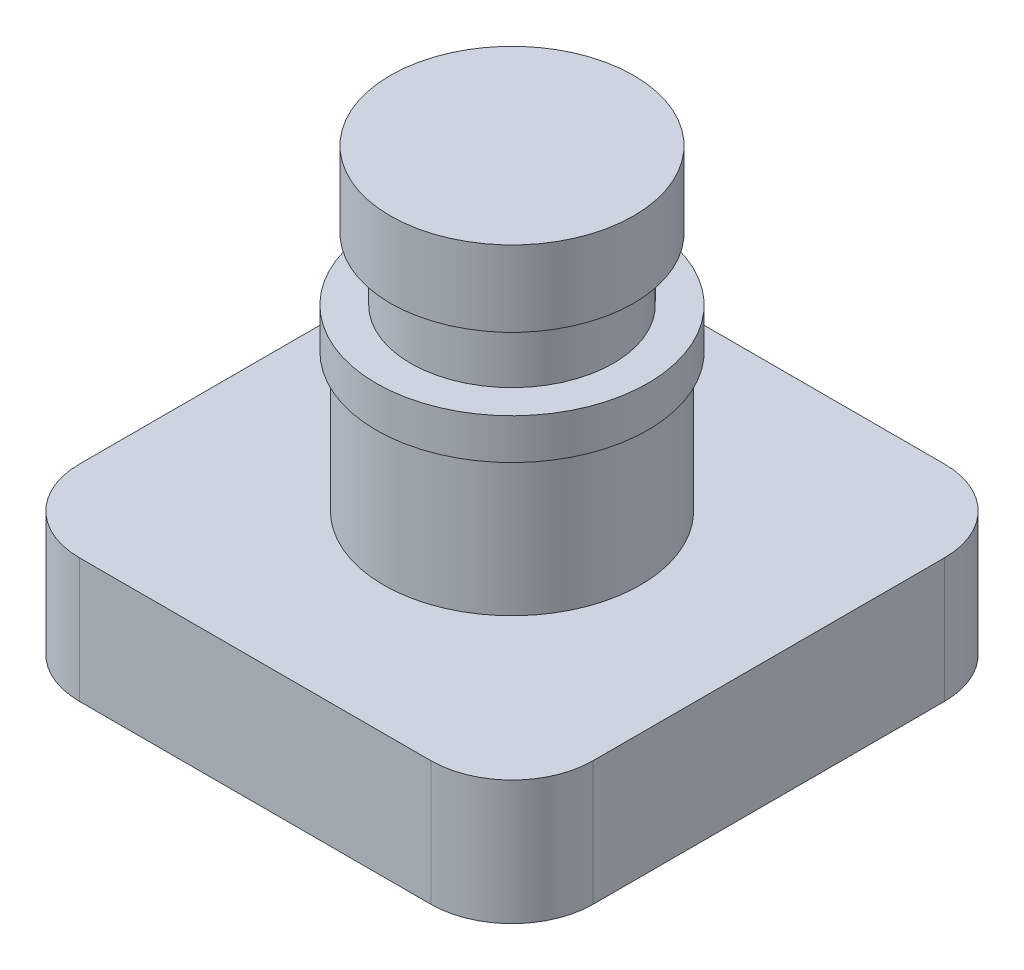
from build123d import *

# Parameters (mm, degrees)
SALIENTE_EXTRUIR2_DEPTH      = 4.6
SALIENTE_EXTRUIR3_DEPTH      = 5.1
SALIENTE_EXTRUIR3_DEPTH_BACK = 4.6
CROQUIS2_R                   = 4.75
CROQUIS4_R                   = 5.025
SALIENTE_EXTRUIR4_DEPTH      = 1.5
CROQUIS6_R                   = 3.75
SALIENTE_EXTRUIR5_DEPTH      = 2.3
CROQUIS7_R                   = 4.5
SALIENTE_EXTRUIR6_DEPTH      = 2.8


with BuildPart() as part:
    # Croquis1 → Saliente-Extruir2 (new body)
    # profile 1 of 5: a face of its own
    with BuildSketch(Plane(origin=(0, 0, 0), x_dir=(1, 0, 0), z_dir=(0, 1, 0))):
        with BuildLine():
            ThreePointArc((6.5, 9.5), (8.621320344, 8.621320344), (9.5, 6.5))
            Line((9.5, 6.5), (9.5, -6.5))
            ThreePointArc((9.5, -6.5), (8.621320344, -8.621320344), (6.5, -9.5))
            Line((6.5, -9.5), (-6.5, -9.5))
            ThreePointArc((-6.5, -9.5), (-8.621320344, -8.621320344), (-9.5, -6.5))
            Line((-9.5, -6.5), (-9.5, 6.5))
            ThreePointArc((-9.5, 6.5), (-8.621320344, 8.621320344), (-6.5, 9.5))
            Line((-6.5, 9.5), (6.5, 9.5))
        make_face()
        with BuildLine():
            ThreePointArc((4.25, -4.75), (4.603553391, -4.603553391), (4.75, -4.25))
            Line((4.75, -4.25), (4.75, 4.25))
            ThreePointArc((4.75, 4.25), (4.603553391, 4.603553391), (4.25, 4.75))
            Line((4.25, 4.75), (-4.25, 4.75))
            ThreePointArc((-4.25, 4.75), (-4.603553391, 4.603553391), (-4.75, 4.25))
            Line((-4.75, 4.25), (-4.75, -4.25))
            ThreePointArc((-4.75, -4.25), (-4.603553391, -4.603553391), (-4.25, -4.75))
            Line((-4.25, -4.75), (4.25, -4.75))
        make_face(mode=Mode.SUBTRACT)
    # profile 2 of 5: a face of its own
    with BuildSketch(Plane(origin=(0, 0, 0), x_dir=(1, 0, 0), z_dir=(0, 1, 0))):
        with BuildLine():
            ThreePointArc((0, -4.75), (-3.358757211, -3.358757211), (-4.75, 0))
            Line((-4.75, 0), (-4.75, -4.25))
            ThreePointArc((-4.75, -4.25), (-4.603553391, -4.603553391), (-4.25, -4.75))
            Line((-4.25, -4.75), (0, -4.75))
        make_face()
    # profile 3 of 5: a face of its own
    with BuildSketch(Plane(origin=(0, 0, 0), x_dir=(1, 0, 0), z_dir=(0, 1, 0))):
        with BuildLine():
            Line((4.75, -4.25), (4.75, 0))
            ThreePointArc((4.75, 0), (3.358757211, -3.358757211), (0, -4.75))
            Line((0, -4.75), (4.25, -4.75))
            ThreePointArc((4.25, -4.75), (4.603553391, -4.603553391), (4.75, -4.25))
        make_face()
    # profile 4 of 5: a face of its own
    with BuildSketch(Plane(origin=(0, 0, 0), x_dir=(1, 0, 0), z_dir=(0, 1, 0))):
        with BuildLine():
            Line((4.25, 4.75), (0, 4.75))
            ThreePointArc((0, 4.75), (3.358757211, 3.358757211), (4.75, 0))
            Line((4.75, 0), (4.75, 4.25))
            ThreePointArc((4.75, 4.25), (4.603553391, 4.603553391), (4.25, 4.75))
        make_face()
    # profile 5 of 5: a face of its own
    with BuildSketch(Plane(origin=(0, 0, 0), x_dir=(1, 0, 0), z_dir=(0, 1, 0))):
        with BuildLine():
            Line((0, 4.75), (-4.25, 4.75))
            ThreePointArc((-4.25, 4.75), (-4.603553391, 4.603553391), (-4.75, 4.25))
            Line((-4.75, 4.25), (-4.75, 0))
            ThreePointArc((-4.75, 0), (-3.358757211, 3.358757211), (0, 4.75))
        make_face()
    extrude(amount=SALIENTE_EXTRUIR2_DEPTH)

    # Croquis2 → Saliente-Extruir3 (add, two sides: drawn at the far end of the back side and taken through both)
    with BuildSketch(Plane(origin=(0, 4.6, 0), x_dir=(1, 0, 0), z_dir=(0, 1, 0)).offset(-SALIENTE_EXTRUIR3_DEPTH_BACK)):
        with Locations(Location((0, 0, 0), (0, 0, 270))):
            Circle(CROQUIS2_R)
    extrude(amount=SALIENTE_EXTRUIR3_DEPTH + SALIENTE_EXTRUIR3_DEPTH_BACK)

    # Croquis4 → Saliente-Extruir4 (add)
    with BuildSketch(Plane(origin=(0, 9.7, 0), x_dir=(1, 0, 0), z_dir=(0, 1, 0))):
        with Locations(Location((0, 0, 0), (0, 0, 270))):
            Circle(CROQUIS4_R)
    extrude(amount=SALIENTE_EXTRUIR4_DEPTH)

    # Croquis6 → Saliente-Extruir5 (add)
    with BuildSketch(Plane(origin=(0, 11.2, 0), x_dir=(1, 0, 0), z_dir=(0, 1, 0))):
        with Locations(Location((0, 0, 0), (0, 0, 270))):
            Circle(CROQUIS6_R)
    extrude(amount=SALIENTE_EXTRUIR5_DEPTH)

    # Croquis7 → Saliente-Extruir6 (add)
    with BuildSketch(Plane(origin=(0, 13.5, 0), x_dir=(1, 0, 0), z_dir=(0, 1, 0))):
        with Locations(Location((0, 0, 0), (0, 0, 270))):
            Circle(CROQUIS7_R)
    extrude(amount=SALIENTE_EXTRUIR6_DEPTH)


solid = part.part
